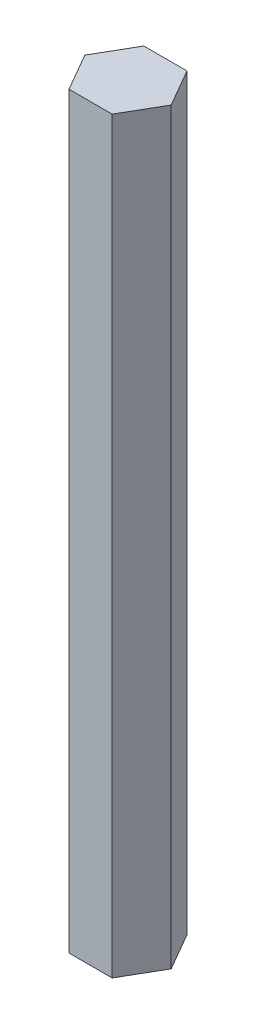
from build123d import *

# Parameters (mm, degrees)
BOSS_EXTRUDE1_DEPTH = 50


with BuildPart() as part:
    # Sketch1 → Boss-Extrude1 (new body)
    with BuildSketch(Plane(origin=(0, 0, 0), x_dir=(1, 0, 0), z_dir=(0, 1, 0))):
        Polygon((2.886751346, 0), (1.443375673, 2.5), (-1.443375673, 2.5), (-2.886751346, 0), (-1.443375673, -2.5), (1.443375673, -2.5), align=None)
    extrude(amount=BOSS_EXTRUDE1_DEPTH)


solid = part.part
